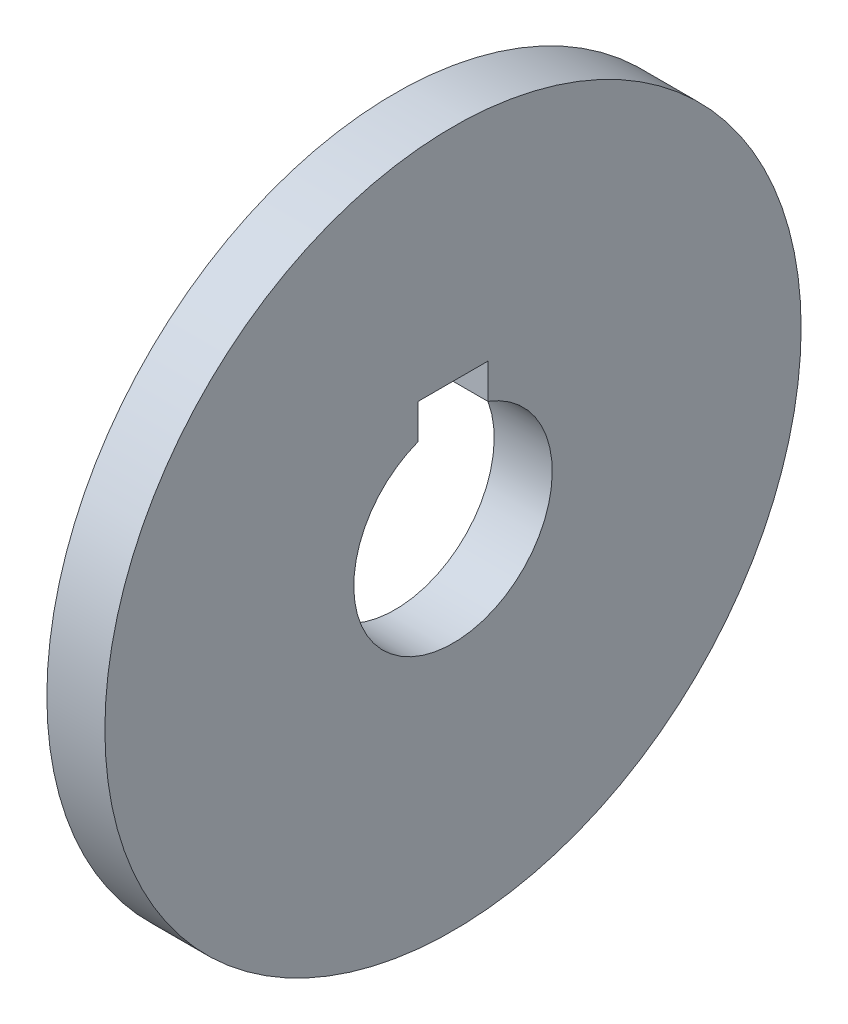
from build123d import *

# Parameters (mm, degrees)
SKETCH1_R           = 30
BOSS_EXTRUDE1_DEPTH = 2.5
CUT_EXTRUDE4_DEPTH  = 43.720018727


with BuildPart() as part:
    # Sketch1 → Boss-Extrude1 (new, symmetric)
    with BuildSketch(Plane(origin=(0, 0, 0), x_dir=(0, 0, -1), z_dir=(1, 0, 0))):
        Circle(SKETCH1_R)
    extrude(amount=BOSS_EXTRUDE1_DEPTH, both=True)

    # Sketch8 → Cut-Extrude4 (cut, through all)
    with BuildSketch(Plane(origin=(2.5, 0, 0), x_dir=(0, 0, -1), z_dir=(1, 0, 0))):
        with BuildLine():
            Line((0, 11.006403687), (-3, 11.006403687))
            Line((-3, 11.006403687), (-3, 8.006403687))
            ThreePointArc((-3, 8.006403687), (0, -8.55), (3, 8.006403687))
            Line((3, 8.006403687), (3, 11.006403687))
            Line((3, 11.006403687), (0, 11.006403687))
        make_face()
    extrude(amount=-CUT_EXTRUDE4_DEPTH, mode=Mode.SUBTRACT)


solid = part.part
